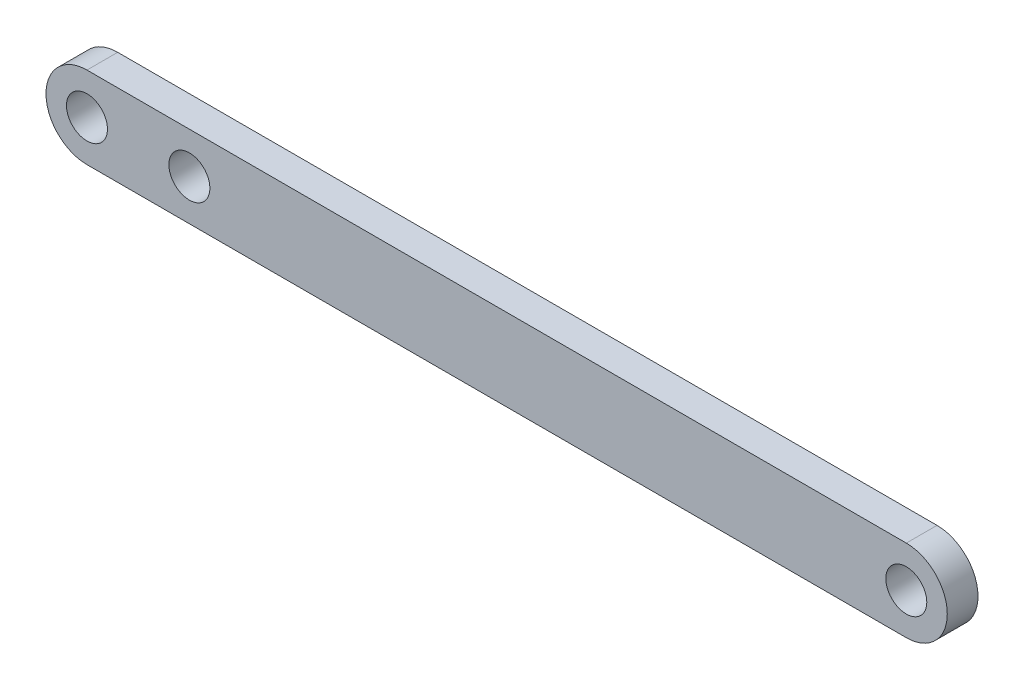
from build123d import *

# Parameters (mm, degrees)
SKETCH_1_R      = 1
EXTRUDE_1_DEPTH = 1.5


with BuildPart() as part:
    # 草图1 → 凸台-拉伸1 (new body)
    with BuildSketch(Plane.XY):
        with BuildLine():
            Line((0, 2), (40, 2))
            ThreePointArc((40, 2), (42, 0), (40, -2))
            Line((40, -2), (0, -2))
            ThreePointArc((0, -2), (-2, 0), (0, 2))
        make_face()
        with Locations((40, 0)):
            Circle(SKETCH_1_R, mode=Mode.SUBTRACT)
        Circle(SKETCH_1_R, mode=Mode.SUBTRACT)
        with Locations((5, 0)):
            Circle(SKETCH_1_R, mode=Mode.SUBTRACT)
    extrude(amount=EXTRUDE_1_DEPTH)


solid = part.part
